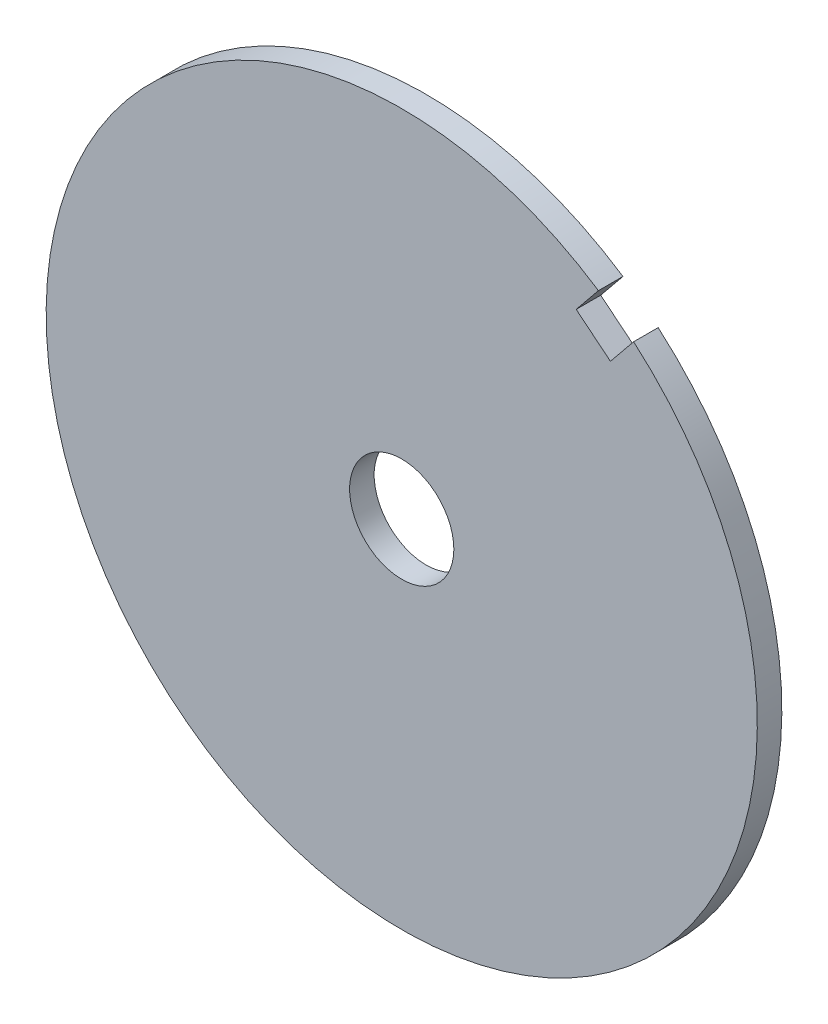
from build123d import *

# Parameters (mm, degrees)
SKETCH1_R               = 92.075
BOSS_EXTRUDE1_DEPTH     = 6.35
CUT_EXTRUDE1_REACH      = 132.368
SKETCH2_R               = 13.49375
CUT_EXTRUDE2_DEPTH      = 131.368453815
CUT_EXTRUDE2_DEPTH_BACK = 131.368453815


with BuildPart() as part:
    # Sketch1 → Boss-Extrude1 (new body)
    with BuildSketch(Plane.XY.offset(3372.777793208)):
        Circle(SKETCH1_R)
    extrude(amount=BOSS_EXTRUDE1_DEPTH)

    # Sketch2 → Cut-Extrude1 (cut, up to next)
    with BuildSketch(Plane.XY.offset(3379.127793208), mode=Mode.PRIVATE) as cut_extrude1_sk1:
        Circle(SKETCH2_R)
    cut_extrude1_tool1 = extrude(cut_extrude1_sk1.sketch, amount=-CUT_EXTRUDE1_REACH, mode=Mode.PRIVATE) & part.part
    add(cut_extrude1_tool1.solids().sort_by_distance((0, 0, 3379.127793))[0], mode=Mode.SUBTRACT)

    # Sketch3 → Cut-Extrude2 (cut, two sides: drawn at the far end of the back side and taken through both)
    with BuildSketch(Plane.XY.offset(3379.127793208).offset(-CUT_EXTRUDE2_DEPTH_BACK)):
        Polygon((337.604296064, 429.104456568), (50.93576887, 76.70301868), (45.174400493, 69.620572204), (54.041166162, 62.407711012), (60.051883822, 69.796682403), (346.720411016, 422.198120291), (895.364622285, 1146.388703686), (886.248507333, 1153.295039963), align=None)
    extrude(amount=CUT_EXTRUDE2_DEPTH + CUT_EXTRUDE2_DEPTH_BACK, mode=Mode.SUBTRACT)


solid = part.part
